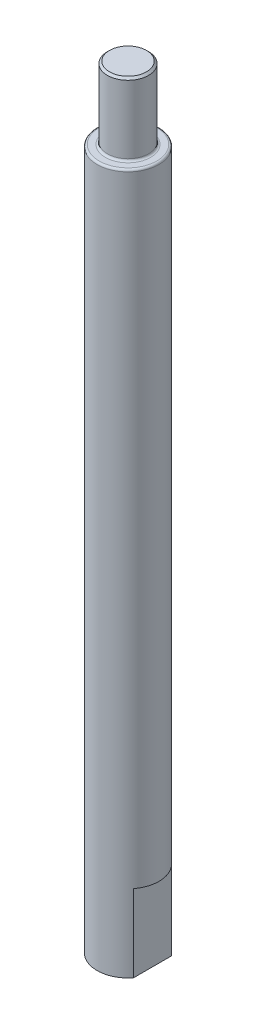
from build123d import *

# Parameters (mm, degrees)
SKETCH2_W          = 2.5
SKETCH2_H          = 15
CUT_EXTRUDE1_DEPTH = 15
CHAMFER1_SIZE      = 0.4
FILLET1_R          = 0.4


with BuildPart() as part:
    # Sketch1 → Revolve1 (revolve)
    with BuildSketch(Plane.XY):
        Polygon((0, 0), (-6, 0), (-6, 136), (-4, 136), (-4, 150), (0, 150), align=None)
    revolve(axis=Axis((0, 150, 0), (0, -1, 0)))

    # Sketch2 → Cut-Extrude1 (cut, symmetric)
    with BuildSketch(Plane.XY):
        with Locations((-6, 7.5)):
            Rectangle(SKETCH2_W, SKETCH2_H)
    cut_extrude1 = extrude(amount=CUT_EXTRUDE1_DEPTH, both=True, mode=Mode.SUBTRACT)

    # Mirror1: Cut-Extrude1 across plane
    add(cut_extrude1.mirror(Plane(origin=(0, 0, 0), x_dir=(0, 0, 1), z_dir=(1, 0, 0))), mode=Mode.SUBTRACT)

    # Chamfer1
    chamfer1_edges = [part.edges().sort_by_distance(p)[0] for p in [
        (4, 150, 0),
    ]]
    chamfer(chamfer1_edges, length=CHAMFER1_SIZE)

    # Fillet1
    fillet1_edges = [part.edges().sort_by_distance(p)[0] for p in [
        (4, 136, 0),
        (6, 136, 0),
    ]]
    fillet(fillet1_edges, radius=FILLET1_R)


solid = part.part
